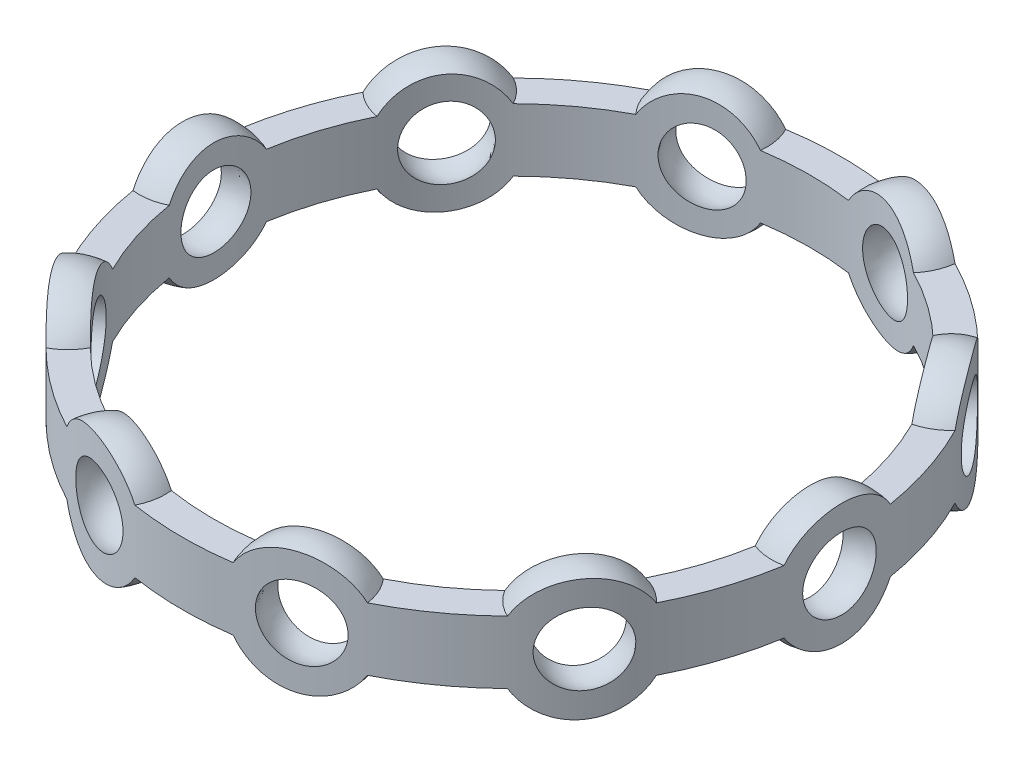
from build123d import *

# Parameters (mm, degrees)
SKETCH_1_R               = 10
EXTRUDE_1_DEPTH          = 0.5
PATTERN_CIRCULAR_1_COUNT = 10
SKETCH_3_OUTSIDE_W       = 27.67
SKETCH_3_OUTSIDE_H       = 27.67
SKETCH_3_OUTSIDE_R       = 5.25
SKETCH_3_OUTSIDE_R_2     = 4.75
CUT_EXTRUDE_1_DEPTH      = 5.75
PATTERN_CIRCULAR_2_COUNT = 10


with BuildPart() as part:
    # 草图1 → 凸台-拉伸1 (new, symmetric)
    with BuildSketch(Plane(origin=(0, 0, 0), x_dir=(1, 0, 0), z_dir=(0, 1, 0))):
        with Locations(Location((0, 0, 0), (0, 0, 270))):
            Circle(SKETCH_1_R)
    extrude(amount=EXTRUDE_1_DEPTH, both=True)

    # 草图2 → 旋转1 (revolve)
    with BuildSketch(Plane.XY):
        with BuildLine():
            Line((5, -1), (5, 1))
            ThreePointArc((5, 1), (6, 0), (5, -1))
        make_face()
    revolve_1 = revolve(axis=Axis((5, -1, 0), (0, 1, 0)))

    # 阵列(圆周)1: 旋转1 ×10 about axis
    pattern_circular_1_axis = Axis((-0.037783375, 0, 0), (0, 1, 0))
    for i in range(1, PATTERN_CIRCULAR_1_COUNT):
        add(revolve_1.rotate(pattern_circular_1_axis, i * 360 / PATTERN_CIRCULAR_1_COUNT))

    # 草图3 outside → 切除-拉伸1 (cut, symmetric)
    # profile 1 of 2: a face of its own
    with BuildSketch(Plane(origin=(0, 0.5, 0), x_dir=(1, 0, 0), z_dir=(0, 1, 0))):
        Rectangle(SKETCH_3_OUTSIDE_W, SKETCH_3_OUTSIDE_H)
        with Locations(Location((0, 0, 0), (0, 0, 278.248585242))):
            Circle(SKETCH_3_OUTSIDE_R, mode=Mode.SUBTRACT)
    # profile 2 of 2: a face of its own
    with BuildSketch(Plane(origin=(0, 0.5, 0), x_dir=(1, 0, 0), z_dir=(0, 1, 0))):
        with Locations(Location((0, 0, 0), (0, 0, 277.954354476))):
            Circle(SKETCH_3_OUTSIDE_R_2)
    extrude(amount=CUT_EXTRUDE_1_DEPTH, both=True, mode=Mode.SUBTRACT)

    # 草图4 → 切除-旋转1 (revolve, cut)
    with BuildSketch(Plane.XY):
        with BuildLine():
            Line((5, -0.625), (5, 0.625))
            ThreePointArc((5, 0.625), (5.625, 0), (5, -0.625))
        make_face()
    cut_revolve_1 = revolve(axis=Axis((5, -0.625, 0), (0, 1, 0)), mode=Mode.SUBTRACT)

    # 阵列(圆周)2: 切除-旋转1 ×10 about axis
    pattern_circular_2_axis = Axis((0, 0, 0), (0, 1, 0))
    for i in range(1, PATTERN_CIRCULAR_2_COUNT):
        add(cut_revolve_1.rotate(pattern_circular_2_axis, i * 360 / PATTERN_CIRCULAR_2_COUNT), mode=Mode.SUBTRACT)


solid = part.part
